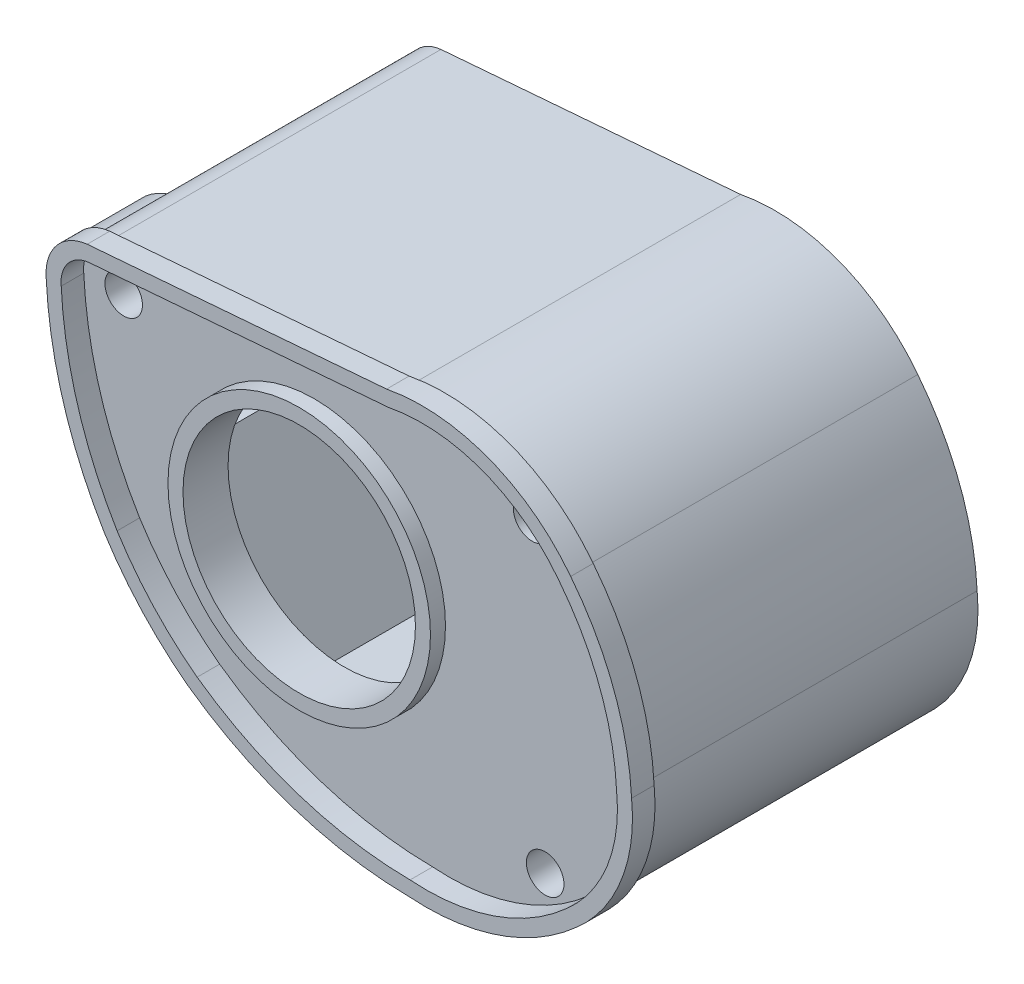
from build123d import *

# Parameters (mm, degrees)
SKETCH1_R           = 15.473305228
BOSS_EXTRUDE1_DEPTH = 44
CUT_EXTRUDE1_DEPTH  = 40
SKETCH11_R          = 2.5
CUT_EXTRUDE5_DEPTH  = 5
SKETCH13_R          = 1.5
CUT_EXTRUDE6_DEPTH  = 10
EXTRUDE_THIN1_DEPTH = 3
SKETCH15_R          = 17.473305228
SKETCH15_R_2        = 15.473305228
EXTRUDE_THIN2_DEPTH = 2
SKETCH16_R          = 4.5
BOSS_EXTRUDE3_DEPTH = 10


with BuildPart() as part:
    # Sketch1 → Boss-Extrude1 (new body)
    with BuildSketch(Plane.XY):
        with BuildLine():
            Line((-33.460012183, 24.105358493), (6.44060775, 27.337295096))
            ThreePointArc((6.44060775, 27.337295096), (19.511223581, 26.215252174), (30.02344729, 18.367123019))
            ThreePointArc((30.02344729, 18.367123019), (35.615507496, 8.492393106), (37.923471704, -2.618625272))
            ThreePointArc((37.923471704, -2.618625272), (36.602926602, -12.338143221), (30.918344751, -20.331790555))
            ThreePointArc((30.918344751, -20.331790555), (20.90952312, -26.221839229), (9.390207544, -27.696475614))
            ThreePointArc((9.390207544, -27.696475614), (-5.783622527, -25.229282546), (-19.509023413, -18.30501138))
            ThreePointArc((-19.509023413, -18.30501138), (-25.50374799, -12.890541162), (-30.425344214, -6.484988797))
            ThreePointArc((-30.425344214, -6.484988797), (-35.759622679, 5.519916373), (-38.010488257, 18.462322604))
            ThreePointArc((-38.010488257, 18.462322604), (-36.903961219, 22.226275001), (-33.460012183, 24.105358493))
        make_face()
        with Locations(Location((-6.328229734, 1.931646276, 0), (0, 0, 180))):
            Circle(SKETCH1_R, mode=Mode.SUBTRACT)
    extrude(amount=BOSS_EXTRUDE1_DEPTH)

    # Sketch2 → Cut-Extrude1 (cut)
    with BuildSketch(Plane(origin=(0, 0, 0), x_dir=(-1, 0, 0), z_dir=(0, 0, -1))):
        with BuildLine():
            Line((32.589203678, 16.132996937), (-19.395696883, 20.841993812))
            Line((-19.395696883, 20.841993812), (-20.554693465, 18.929777625))
            Line((-20.554693465, 18.929777625), (-21.602789168, 10.988646033))
            ThreePointArc((-21.602789168, 10.988646033), (-24.682296454, -0.374799149), (-26.534540168, -12.001511701))
            ThreePointArc((-26.534540168, -12.001511701), (-13.846491261, -23.475208696), (2.686334367, -19.082261559))
            Line((2.686334367, -19.082261559), (14.1483705, -20.015779015))
            Line((14.1483705, -20.015779015), (25.98241591, 2.09655619))
            Line((25.98241591, 2.09655619), (30.047601379, 1.765470024))
            ThreePointArc((30.047601379, 1.765470024), (30.755878379, 3.115232347), (31.639547807, 4.357264141))
            Line((31.639547807, 4.357264141), (32.589203678, 16.132996937))
        make_face()
    extrude(amount=-CUT_EXTRUDE1_DEPTH, mode=Mode.SUBTRACT)

    # Sketch11 → Cut-Extrude5 (cut)
    with BuildSketch(Plane.XY.offset(44)):
        with Locations((22.682806968, 19.978071842)):
            Circle(SKETCH11_R)
        with Locations((-31.693806202, 18.756611951)):
            Circle(SKETCH11_R)
        with Locations((24.419060413, -19.953201173)):
            Circle(SKETCH11_R)
    extrude(amount=-CUT_EXTRUDE5_DEPTH, mode=Mode.SUBTRACT)

    # Sketch13 → Cut-Extrude6 (cut)
    with BuildSketch(Plane.XY.offset(44)):
        with Locations((-31.757557343, 18.733539273)):
            Circle(SKETCH13_R)
        with Locations((22.712029929, 19.97151531)):
            Circle(SKETCH13_R)
        with Locations((24.337392738, -19.997060426)):
            Circle(SKETCH13_R)
    extrude(amount=-CUT_EXTRUDE6_DEPTH, mode=Mode.SUBTRACT)

    # Sketch14 → Extrude-Thin1 (add)
    with BuildSketch(Plane.XY.offset(44)):
        with BuildLine():
            ThreePointArc((-39.007910632, 18.385521852), (-36.710647786, 5.210188188), (-31.276438105, -7.010130911))
            ThreePointArc((-31.276438105, -7.010130911), (-26.238328339, -13.569062876), (-20.099937032, -19.111832102))
            ThreePointArc((-20.099937032, -19.111832102), (-6.114170153, -26.173336976), (9.348749737, -28.696159753))
            ThreePointArc((9.348749737, -28.696159753), (21.243614885, -27.164441879), (31.579782842, -21.081875933))
            ThreePointArc((31.579782842, -21.081875933), (37.52971495, -12.713819205), (38.920828499, -2.540773025))
            ThreePointArc((38.920828499, -2.540773025), (36.548052351, 8.853568184), (30.812789557, 18.981146321))
            ThreePointArc((30.812789557, 18.981146321), (19.88863716, 27.141581431), (6.304879392, 28.329576255))
            Line((6.304879392, 28.329576255), (-33.553105346, 25.101093087))
            ThreePointArc((-33.553105346, 25.101093087), (-37.668719443, 22.870899287), (-39.007910632, 18.385521852))
        make_face()
        with BuildLine():
            ThreePointArc((-37.013176969, 18.541697373), (-34.808968071, 5.830889726), (-29.574259358, -5.959826648))
            ThreePointArc((-29.574259358, -5.959826648), (-24.769169875, -12.212017029), (-18.918095758, -17.498197235))
            ThreePointArc((-18.918095758, -17.498197235), (-5.452946572, -24.28525911), (9.431913531, -26.696771337))
            ThreePointArc((9.431913531, -26.696771337), (20.575585264, -25.27917956), (30.256964564, -19.581646671))
            ThreePointArc((30.256964564, -19.581646671), (35.676093796, -11.962570151), (36.926108056, -2.696786157))
            ThreePointArc((36.926108056, -2.696786157), (34.683002453, 8.131105233), (29.234060411, 17.753152069))
            ThreePointArc((29.234060411, 17.753152069), (19.134313202, 25.288707505), (6.577502037, 26.345108378))
            Line((6.577502037, 26.345108378), (-33.365641877, 23.109727346))
            ThreePointArc((-33.365641877, 23.109727346), (-36.137926894, 21.58309591), (-37.013176969, 18.541697373))
        make_face(mode=Mode.SUBTRACT)
    extrude(amount=EXTRUDE_THIN1_DEPTH)

    # Sketch15 → Extrude-Thin2 (add)
    with BuildSketch(Plane.XY.offset(44)):
        with Locations((-6.328229734, 1.931646276)):
            Circle(SKETCH15_R)
        with Locations((-6.328229734, 1.931646276)):
            Circle(SKETCH15_R_2, mode=Mode.SUBTRACT)
    extrude(amount=EXTRUDE_THIN2_DEPTH)


with BuildPart() as body_2:
    # Sketch16 → Boss-Extrude3 (new body)
    with BuildSketch(Plane.XY.offset(20)):
        with BuildLine():
            Line((-36.862226699, 9.763374101), (-46.862226699, 9.763374101))
            ThreePointArc((-46.862226699, 9.763374101), (-55.861417589, 0.764183211), (-46.862226699, -8.235007679))
            Line((-46.862226699, -8.235007679), (-29.258325932, -8.235007679))
            ThreePointArc((-29.258325932, -8.235007679), (-33.913658423, 0.403648973), (-36.862226699, 9.763374101))
        make_face()
        with Locations((-46.862226699, 0.764183211)):
            Circle(SKETCH16_R, mode=Mode.SUBTRACT)
    extrude(amount=BOSS_EXTRUDE3_DEPTH)


solid = Compound([part.part, body_2.part])
